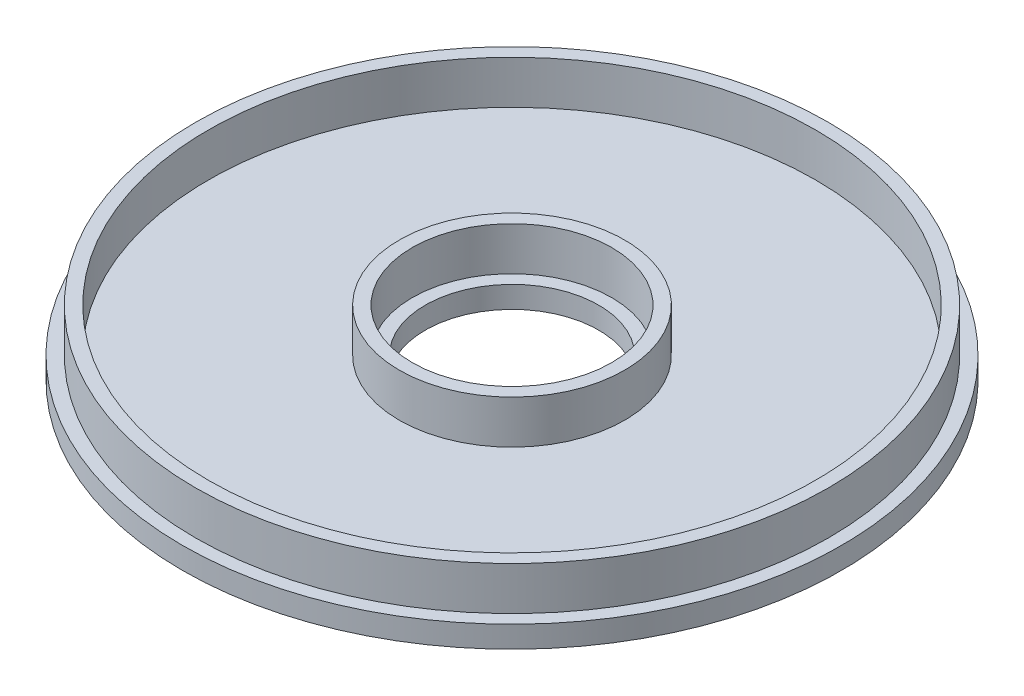
from build123d import *

# Parameters (mm, degrees)
SKETCH1_R           = 76
SKETCH1_R_2         = 20
BOSS_EXTRUDE1_DEPTH = 5
SKETCH2_R           = 73
SKETCH2_R_2         = 70
SKETCH2_R_3         = 26
SKETCH2_R_4         = 23
BOSS_EXTRUDE2_DEPTH = 10


with BuildPart() as part:
    # Sketch1 → Boss-Extrude1 (new body)
    with BuildSketch(Plane(origin=(0, 0, 0), x_dir=(1, 0, 0), z_dir=(0, 1, 0))):
        with Locations(Location((0, 0, 0), (0, 0, 270))):
            Circle(SKETCH1_R)
        with Locations(Location((0, 0, 0), (0, 0, 270))):
            Circle(SKETCH1_R_2, mode=Mode.SUBTRACT)
    extrude(amount=BOSS_EXTRUDE1_DEPTH)

    # Sketch2 → Boss-Extrude2 (add)
    # profile 1 of 2: a face of its own
    with BuildSketch(Plane(origin=(0, 5, 0), x_dir=(1, 0, 0), z_dir=(0, 1, 0))):
        with Locations(Location((0, 0, 0), (0, 0, 270))):
            Circle(SKETCH2_R)
        with Locations(Location((0, 0, 0), (0, 0, 270))):
            Circle(SKETCH2_R_2, mode=Mode.SUBTRACT)
    # profile 2 of 2: a face of its own
    with BuildSketch(Plane(origin=(0, 5, 0), x_dir=(1, 0, 0), z_dir=(0, 1, 0))):
        with Locations(Location((0, 0, 0), (0, 0, 270))):
            Circle(SKETCH2_R_3)
        with Locations(Location((0, 0, 0), (0, 0, 270))):
            Circle(SKETCH2_R_4, mode=Mode.SUBTRACT)
    extrude(amount=BOSS_EXTRUDE2_DEPTH)


solid = part.part
